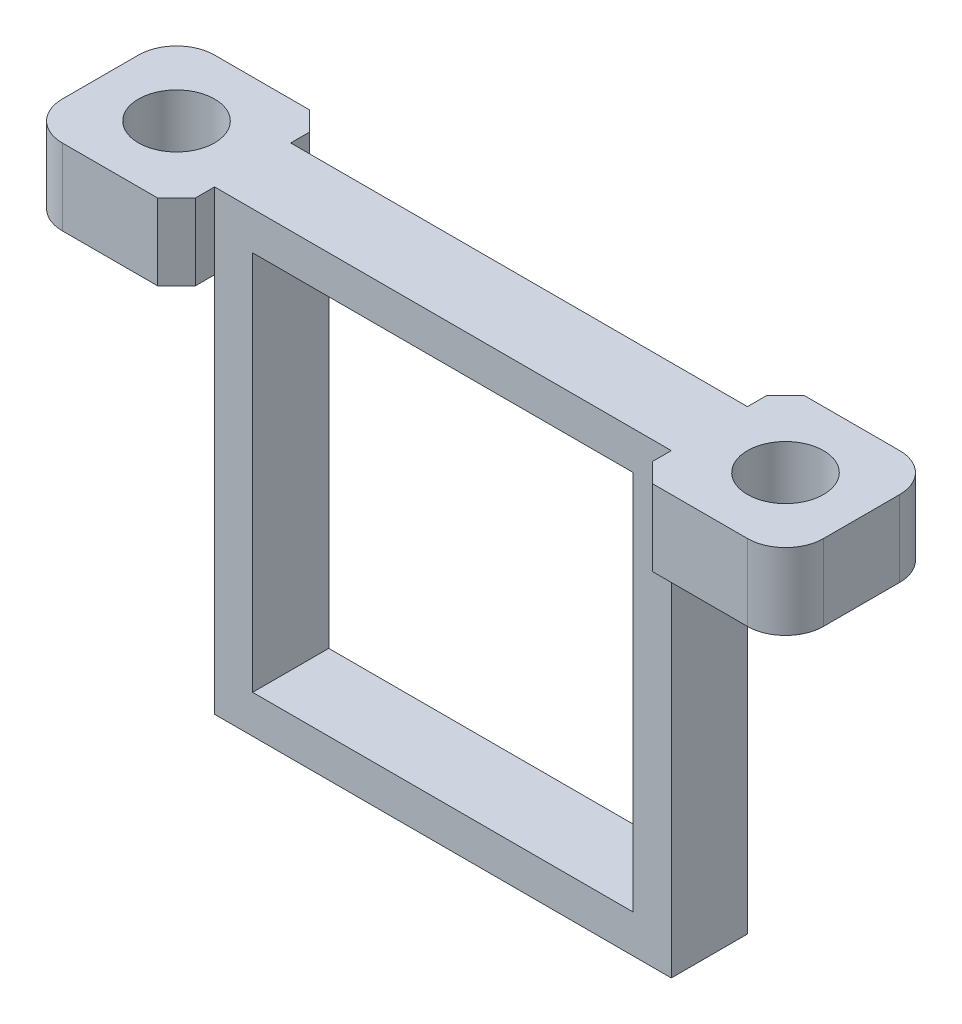
from build123d import *

# Parameters (mm, degrees)
SKETCH_1_W                 = 24
SKETCH_1_H                 = 24
SKETCH_1_W_2               = 20
SKETCH_1_H_2               = 20
EXTRUDE_1_DEPTH            = 4
SKETCH_6_R                 = 2
EXTRUDE_2_DEPTH            = 4
CHAMFER_1_SIZE             = 1
CHAMFER_1_OF_MIRROR_1_SIZE = 1


with BuildPart() as part:
    # Эскиз1 → Бобышка-Вытянуть1 (new body)
    with BuildSketch(Plane.XY):
        Rectangle(SKETCH_1_W, SKETCH_1_H)
        Rectangle(SKETCH_1_W_2, SKETCH_1_H_2, mode=Mode.SUBTRACT)
    extrude(amount=EXTRUDE_1_DEPTH)

    # Эскиз6 → Бобышка-Вытянуть2 (add)
    with BuildSketch(Plane(origin=(0, 12, 0), x_dir=(1, 0, 0), z_dir=(0, 1, 0))):
        with BuildLine():
            Line((-12, 2), (-18, 2))
            ThreePointArc((-18, 2), (-19.414213562, 1.414213562), (-20, 0))
            Line((-20, 0), (-20, -4))
            ThreePointArc((-20, -4), (-19.414213562, -5.414213562), (-18, -6))
            Line((-18, -6), (-12, -6))
            Line((-12, -6), (-12, 2))
        make_face()
        with Locations(Location((-16, -2, 0), (0, 0, 270))):
            Circle(SKETCH_6_R, mode=Mode.SUBTRACT)
    extrude_2 = extrude(amount=-EXTRUDE_2_DEPTH)

    # Фаска1
    chamfer_1_edges = [part.edges().sort_by_distance(p)[0] for p in [
        (-12, 10, -2),
        (-12, 10, 6),
    ]]
    chamfer(chamfer_1_edges, length=CHAMFER_1_SIZE)

    # Зеркальное отражение1: Бобышка-Вытянуть2 across plane
    add(extrude_2.mirror(Plane(origin=(0, 0, 0), x_dir=(0, 0, 1), z_dir=(1, 0, 0))))

    # Фаска1 of Зеркальное отражение1
    chamfer_1_of_mirror_1_edges = [part.edges().sort_by_distance(p)[0] for p in [
        (12, 10, -2),
        (12, 10, 6),
    ]]
    chamfer(chamfer_1_of_mirror_1_edges, length=CHAMFER_1_OF_MIRROR_1_SIZE)


solid = part.part
